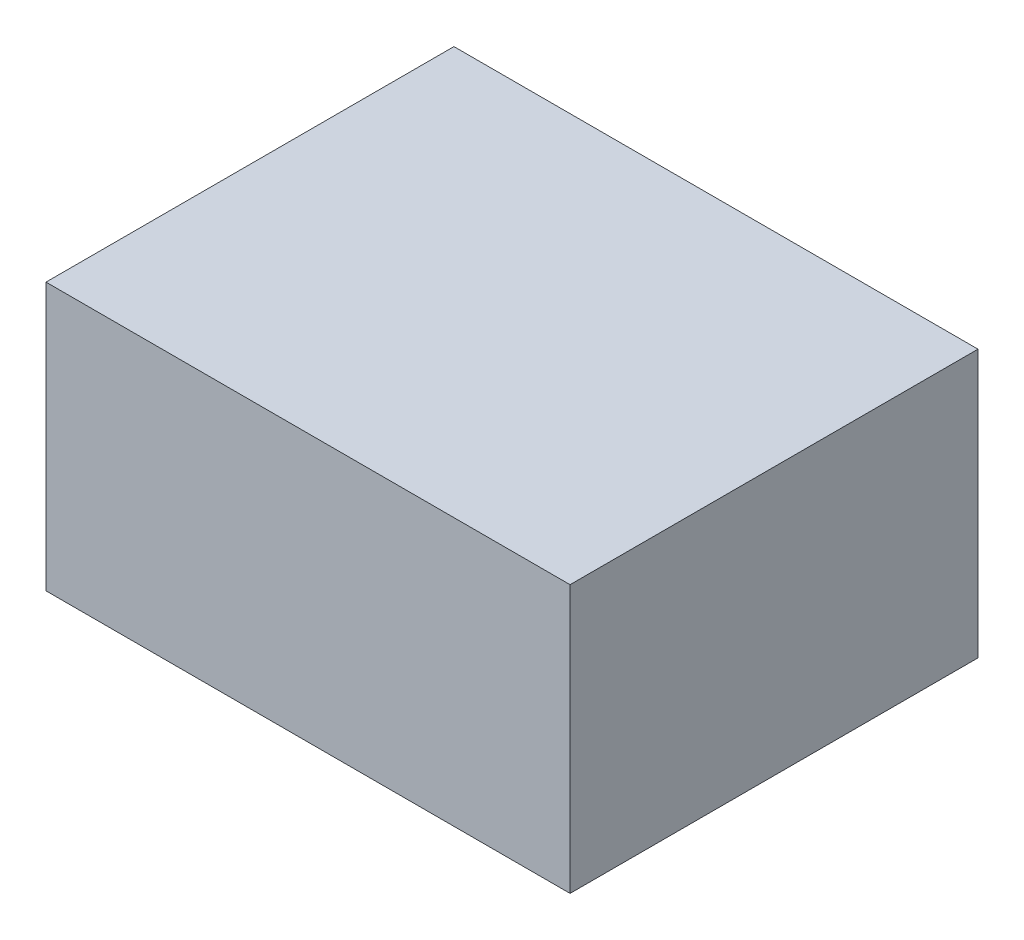
from build123d import *

# Parameters (mm, degrees)
SKETCH1_W           = 68.6
SKETCH1_H           = 53.4
BOSS_EXTRUDE1_DEPTH = 17.5


with BuildPart() as part:
    # Sketch1 → Boss-Extrude1 (new, symmetric)
    with BuildSketch(Plane(origin=(0, 0, 0), x_dir=(1, 0, 0), z_dir=(0, 1, 0))):
        Rectangle(SKETCH1_W, SKETCH1_H)
    extrude(amount=BOSS_EXTRUDE1_DEPTH, both=True)


solid = part.part
